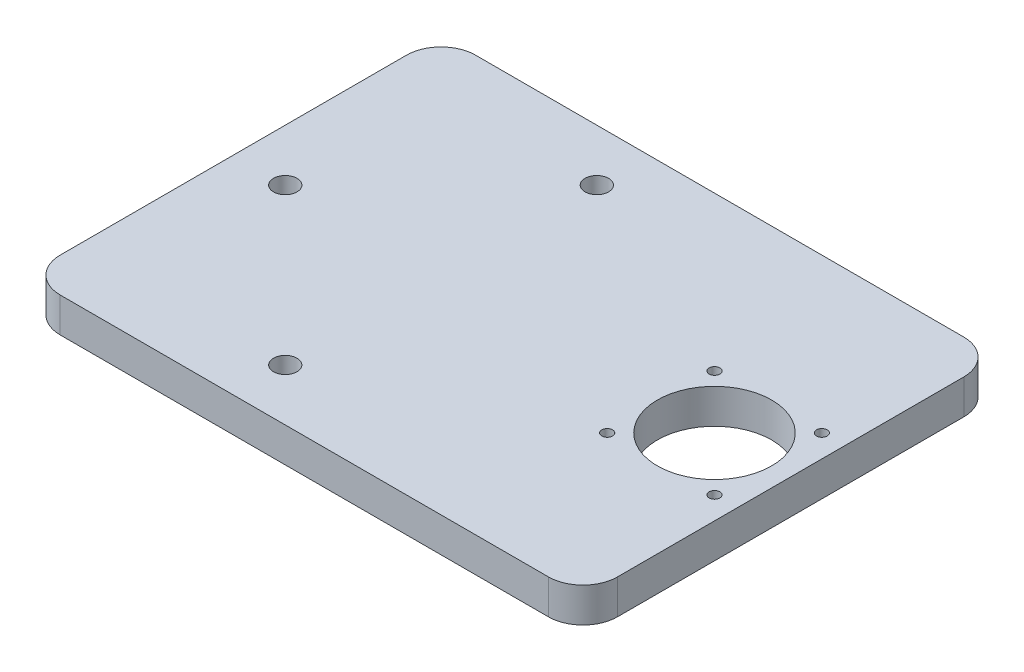
from build123d import *

# Parameters (mm, degrees)
SKETCH_1_W          = 161
SKETCH_1_H          = 120
EXTRUDE_1_DEPTH     = 10
FILLET_1_R          = 10
SKETCH_2_R          = 1.55
CUT_EXTRUDE_1_DEPTH = 10
SKETCH_3_R          = 16.5
CUT_EXTRUDE_2_DEPTH = 10
SKETCH_4_R          = 3.4
CUT_EXTRUDE_3_DEPTH = 101.897224937


with BuildPart() as part:
    # 草图1 → 凸台-拉伸1 (new body)
    with BuildSketch(Plane(origin=(0, 0, 0), x_dir=(1, 0, 0), z_dir=(0, 1, 0))):
        Rectangle(SKETCH_1_W, SKETCH_1_H)
    extrude(amount=EXTRUDE_1_DEPTH)

    # 圆角1
    fillet_1_edges = [part.edges().sort_by_distance(p)[0] for p in [
        (80.5, 5, 60),
        (-80.5, 5, 60),
        (-80.5, 5, -60),
        (80.5, 5, -60),
    ]]
    fillet(fillet_1_edges, radius=FILLET_1_R)

    # 草图2 → 切除-拉伸1 (cut)
    with BuildSketch(Plane(origin=(0, 10, 0), x_dir=(1, 0, 0), z_dir=(0, 1, 0))):
        with Locations(Location((74, 15.5, 0), (0, 0, 270))):
            Circle(SKETCH_2_R)
        with Locations(Location((74, -15.5, 0), (0, 0, 270))):
            Circle(SKETCH_2_R)
        with Locations(Location((43, 15.5, 0), (0, 0, 270))):
            Circle(SKETCH_2_R)
        with Locations(Location((43, -15.5, 0), (0, 0, 270))):
            Circle(SKETCH_2_R)
    extrude(amount=-CUT_EXTRUDE_1_DEPTH, mode=Mode.SUBTRACT)

    # 草图3 → 切除-拉伸2 (cut)
    with BuildSketch(Plane.XZ):
        with Locations(Location((58.5, 0, 0), (0, 0, 270))):
            Circle(SKETCH_3_R)
    extrude(amount=-CUT_EXTRUDE_2_DEPTH, mode=Mode.SUBTRACT)

    # 草图4 → 切除-拉伸3 (cut, through all)
    with BuildSketch(Plane.XZ):
        with Locations(Location((-20.5, 45, 0), (0, 0, 270))):
            Circle(SKETCH_4_R)
        with Locations(Location((-65.5, 0, 0), (0, 0, 270))):
            Circle(SKETCH_4_R)
        with Locations(Location((-20.5, -45, 0), (0, 0, 270))):
            Circle(SKETCH_4_R)
    extrude(amount=-CUT_EXTRUDE_3_DEPTH, mode=Mode.SUBTRACT)


solid = part.part
